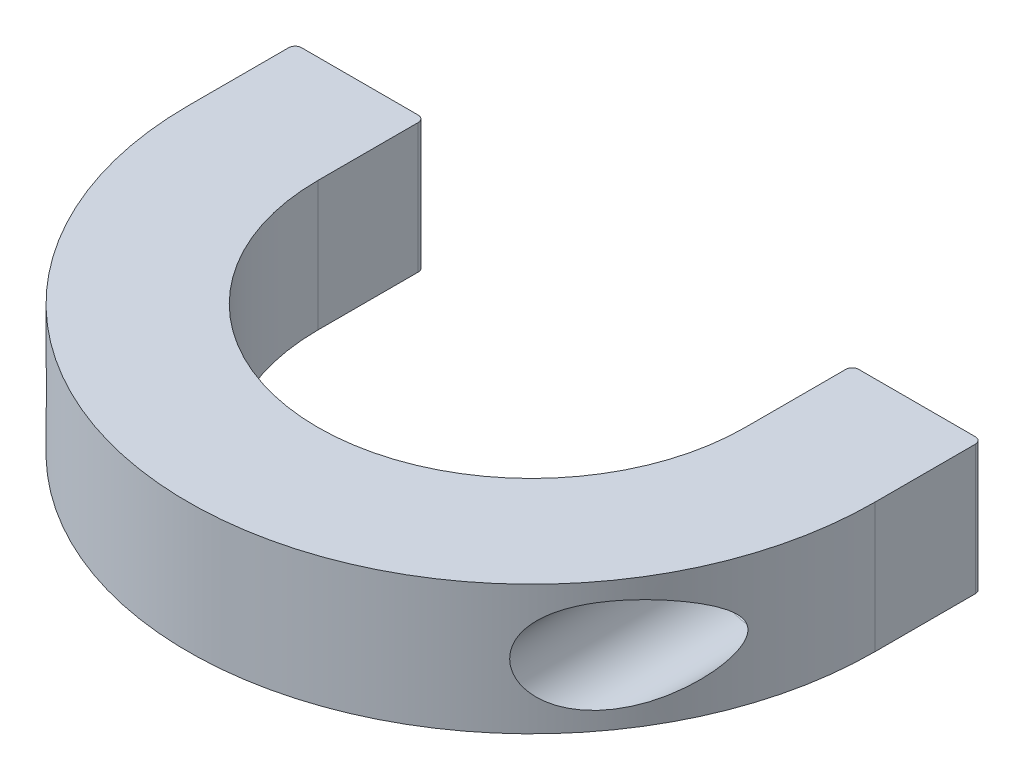
from build123d import *

# Parameters (mm, degrees)
BOSS_EXTRUDE1_DEPTH = 20
SKETCH2_R           = 4.25
CUT_EXTRUDE1_DEPTH  = 60
CUT_EXTRUDE2_START  = -25
SKETCH3_R           = 7.25
CUT_EXTRUDE2_DEPTH  = 50
FILLET1_R           = 1
FILLET2_R           = 0.5


with BuildPart() as part:
    # Sketch1 → Boss-Extrude1 (new body)
    with BuildSketch(Plane(origin=(0, 0, 0), x_dir=(1, 0, 0), z_dir=(0, 1, 0))):
        with BuildLine():
            Line((-33, 0), (-33, 16.5))
            Line((-33, 16.5), (-53, 16.5))
            Line((-53, 16.5), (-53, 0))
            ThreePointArc((-53, 0), (0, -53), (53, 0))
            Line((53, 0), (53, 16.5))
            Line((53, 16.5), (33, 16.5))
            Line((33, 16.5), (33, 0))
            ThreePointArc((33, 0), (0, -33), (-33, 0))
        make_face()
    extrude(amount=BOSS_EXTRUDE1_DEPTH)

    # Sketch2 → Cut-Extrude1 (cut)
    with BuildSketch(Plane(origin=(0, 0, -16.5), x_dir=(-1, 0, 0), z_dir=(0, 0, -1))):
        with Locations((-43, 10)):
            Circle(SKETCH2_R)
        with Locations((43, 10)):
            Circle(SKETCH2_R)
    extrude(amount=-CUT_EXTRUDE1_DEPTH, mode=Mode.SUBTRACT)

    # Sketch3 → Cut-Extrude2 (cut)
    with BuildSketch(Plane(origin=(0, 0, -16.5), x_dir=(-1, 0, 0), z_dir=(0, 0, -1)).offset(CUT_EXTRUDE2_START)):
        with Locations((-43, 10)):
            Circle(SKETCH3_R)
        with Locations((43, 10)):
            Circle(SKETCH3_R)
    extrude(amount=-CUT_EXTRUDE2_DEPTH, mode=Mode.SUBTRACT)

    # Fillet1
    fillet1_edges = [part.edges().sort_by_distance(p)[0] for p in [
        (33, 10, -16.5),
        (53, 10, -16.5),
        (-53, 10, -16.5),
        (-33, 10, -16.5),
    ]]
    fillet(fillet1_edges, radius=FILLET1_R)

    # Fillet2
    fillet2_edges = [part.edges().sort_by_distance(p)[0] for p in [
        (47.25, 10, -16.5),
        (-38.75, 10, -16.5),
        (50.25, 10, 8.5),
        (47.25, 10, 8.5),
        (-35.75, 10, 8.5),
        (-38.75, 10, 8.5),
    ]]
    fillet(fillet2_edges, radius=FILLET2_R)


solid = part.part
